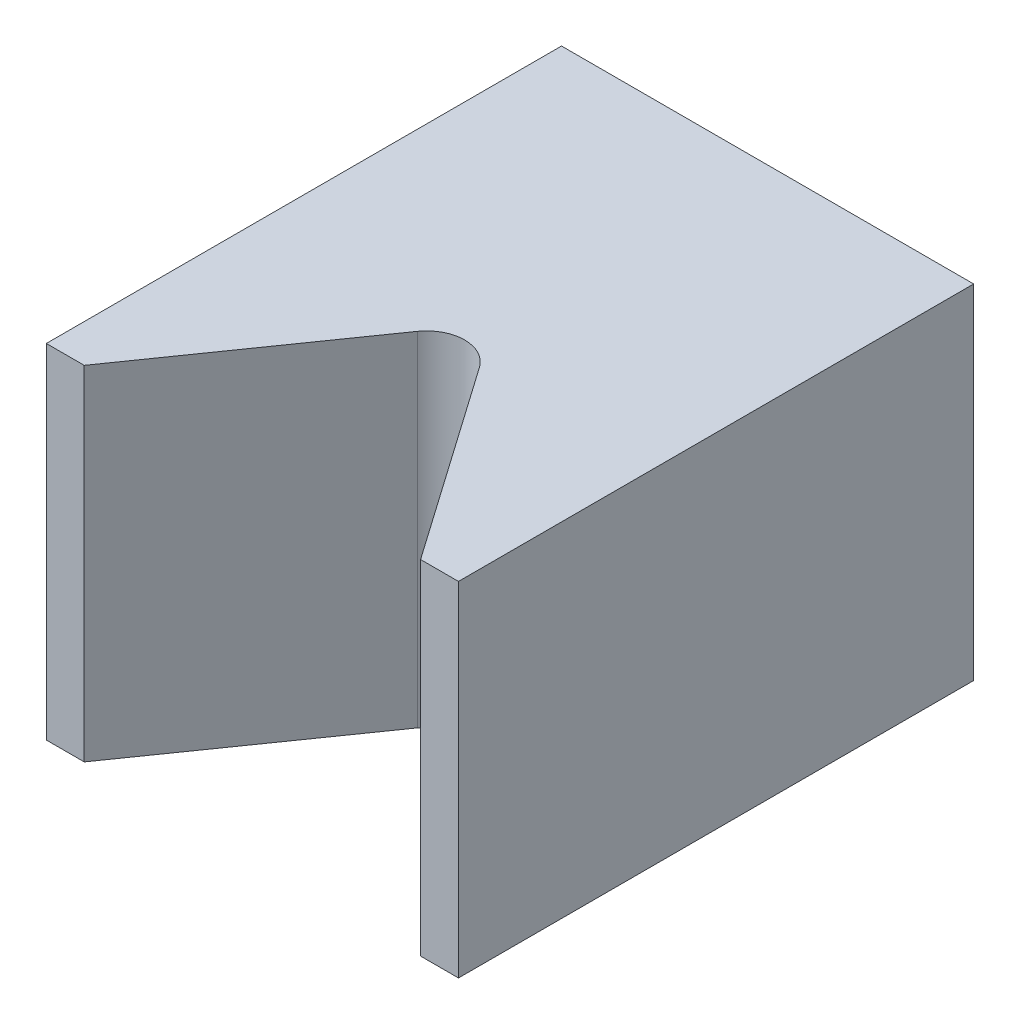
from build123d import *

# Parameters (mm, degrees)
BOSS_EXTRUDE1_DEPTH = 10
CUT_EXTRUDE1_DEPTH  = 7


with BuildPart() as part:
    # Sketch1 → Boss-Extrude1 (new body)
    with BuildSketch(Plane(origin=(0, 0, 0), x_dir=(1, 0, 0), z_dir=(0, 1, 0))):
        with BuildLine():
            Line((0.904649293, 0.632741314), (4.896029025, -5.073854375))
            Line((4.896029025, -5.073854375), (6, -5.073854375))
            Line((6, -5.073854375), (6, 9.926145625))
            Line((6, 9.926145625), (-6, 9.926145625))
            Line((-6, 9.926145625), (-6, -5.073854375))
            Line((-6, -5.073854375), (-4.896029025, -5.073854375))
            Line((-4.896029025, -5.073854375), (-0.904649293, 0.632741314))
            ThreePointArc((-0.904649293, 0.632741314), (0, 1.103970975), (0.904649293, 0.632741314))
        make_face()
    extrude(amount=BOSS_EXTRUDE1_DEPTH)

    # Sketch2 → Cut-Extrude1 (cut)
    with BuildSketch(Plane(origin=(0, 0, -9.926145625), x_dir=(-1, 0, 0), z_dir=(0, 0, -1))):
        with BuildLine():
            ThreePointArc((0, 7.1), (-2.1, 5), (0, 2.9))
            Line((0, 2.9), (0, 7.1))
        make_face()
        with BuildLine():
            Line((0, 7.1), (0, 2.9))
            ThreePointArc((0, 2.9), (1.48492424, 3.51507576), (2.1, 5))
            ThreePointArc((2.1, 5), (1.48492424, 6.48492424), (0, 7.1))
        make_face()
    extrude(amount=-CUT_EXTRUDE1_DEPTH, mode=Mode.SUBTRACT)


solid = part.part
